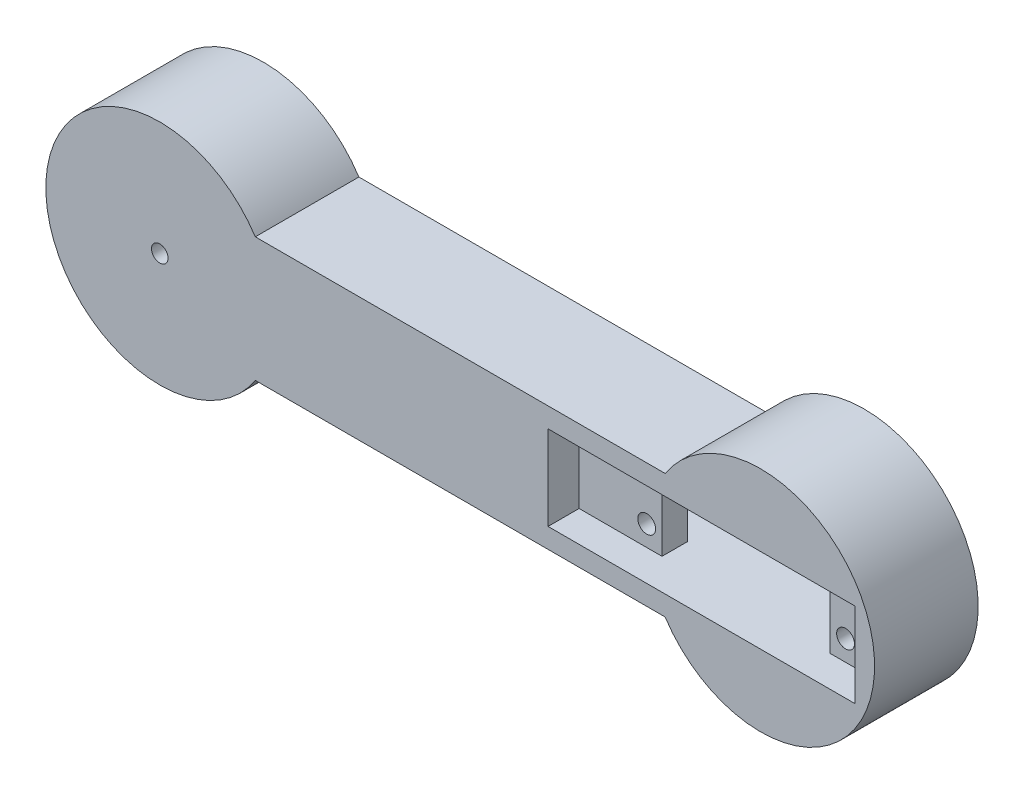
from build123d import *

# Parameters (mm, degrees)
BOSS_EXTRUDE1_DEPTH = 25
SKETCH19_R          = 20
CUT_EXTRUDE14_DEPTH = 5
SKETCH22_R          = 2
CUT_EXTRUDE17_DEPTH = 20
SKETCH23_W          = 54.5
SKETCH23_H          = 20.4
SKETCH23_W_2        = 40.6
CUT_EXTRUDE18_DEPTH = 11.3
CUT_EXTRUDE19_DEPTH = 13.7
SKETCH25_W          = 7.5
SKETCH25_H          = 20.4
CUT_EXTRUDE20_DEPTH = 13.5
CUT_EXTRUDE21_DEPTH = 20
SKETCH27_R          = 2.15
CUT_EXTRUDE22_DEPTH = 12


with BuildPart() as part:
    # Sketch1 → Boss-Extrude1 (new body)
    with BuildSketch(Plane.XY):
        with BuildLine():
            ThreePointArc((172.5, 0), (152.823244805, 26.363741023), (121.951138857, 15))
            Line((121.951138857, 15), (145, 15))
            Line((145, 15), (145, -15))
            Line((145, -15), (121.951138857, -15))
            ThreePointArc((121.951138857, -15), (152.823244805, -26.363741023), (172.5, 0))
        make_face()
        with BuildLine():
            Line((145, 15), (121.951138857, 15))
            ThreePointArc((121.951138857, 15), (117.5, 0), (121.951138857, -15))
            Line((121.951138857, -15), (145, -15))
            Line((145, -15), (145, 15))
        make_face()
        with BuildLine():
            Line((121.951138857, 15), (23.048861143, 15))
            ThreePointArc((23.048861143, 15), (26.363741023, 7.823244805), (27.5, 0))
            ThreePointArc((27.5, 0), (26.363741023, -7.823244805), (23.048861143, -15))
            Line((23.048861143, -15), (121.951138857, -15))
            ThreePointArc((121.951138857, -15), (117.5, 0), (121.951138857, 15))
        make_face()
        with BuildLine():
            ThreePointArc((13.228756555, -15), (-20, 0), (13.228756555, 15))
            Line((13.228756555, 15), (23.048861143, 15))
            ThreePointArc((23.048861143, 15), (-27.5, 0), (23.048861143, -15))
            Line((23.048861143, -15), (13.228756555, -15))
        make_face()
        with BuildLine():
            Line((23.048861143, 15), (13.228756555, 15))
            ThreePointArc((13.228756555, 15), (18.228756555, 8.228756555), (20, 0))
            ThreePointArc((20, 0), (18.228756555, -8.228756555), (13.228756555, -15))
            Line((13.228756555, -15), (23.048861143, -15))
            ThreePointArc((23.048861143, -15), (26.363741023, -7.823244805), (27.5, 0))
            ThreePointArc((27.5, 0), (26.363741023, 7.823244805), (23.048861143, 15))
        make_face()
        with BuildLine():
            Line((0, -15), (0, 15))
            Line((0, 15), (13.228756555, 15))
            ThreePointArc((13.228756555, 15), (-20, 0), (13.228756555, -15))
            Line((13.228756555, -15), (0, -15))
        make_face()
        with BuildLine():
            Line((13.228756555, 15), (0, 15))
            Line((0, 15), (0, -15))
            Line((0, -15), (13.228756555, -15))
            ThreePointArc((13.228756555, -15), (18.228756555, -8.228756555), (20, 0))
            ThreePointArc((20, 0), (18.228756555, 8.228756555), (13.228756555, 15))
        make_face()
    extrude(amount=BOSS_EXTRUDE1_DEPTH)

    # Sketch19 → Cut-Extrude14 (cut)
    with BuildSketch(Plane(origin=(0, 0, 0), x_dir=(-1, 0, 0), z_dir=(0, 0, -1))):
        Circle(SKETCH19_R)
    extrude(amount=-CUT_EXTRUDE14_DEPTH, mode=Mode.SUBTRACT)

    # Sketch22 → Cut-Extrude17 (cut)
    with BuildSketch(Plane.XY.offset(25)):
        Circle(SKETCH22_R)
    extrude(amount=-CUT_EXTRUDE17_DEPTH, mode=Mode.SUBTRACT)

    # Sketch23 → Cut-Extrude18 (cut)
    with BuildSketch(Plane(origin=(0, 0, 0), x_dir=(-1, 0, 0), z_dir=(0, 0, -1))):
        with Locations((-134, 0)):
            Rectangle(SKETCH23_W, SKETCH23_H)
        with Locations((-134, 0)):
            Rectangle(SKETCH23_W_2, SKETCH23_H)
    extrude(amount=-CUT_EXTRUDE18_DEPTH, mode=Mode.SUBTRACT)

    # Sketch24 → Cut-Extrude19 (cut)
    with BuildSketch(Plane(origin=(0, 0, 11.3), x_dir=(-1, 0, 0), z_dir=(0, 0, -1))):
        Polygon((-154.3, -0.627488927), (-154.3, -10.2), (-113.7, -10.2), (-113.7, 10.2), (-154.3, 10.2), align=None)
    extrude(amount=-CUT_EXTRUDE19_DEPTH, mode=Mode.SUBTRACT)

    # Sketch25 → Cut-Extrude20 (cut)
    with BuildSketch(Plane.ZY.offset(-154.3)):
        with Locations((21.25, 0)):
            Rectangle(SKETCH25_W, SKETCH25_H)
    extrude(amount=-CUT_EXTRUDE20_DEPTH, mode=Mode.SUBTRACT)

    # Sketch26 → Cut-Extrude21 (cut)
    with BuildSketch(Plane(origin=(113.7, 0, 0), x_dir=(0, 0, -1), z_dir=(1, 0, 0))):
        Polygon((-25, 10.2), (-25, -10.2), (-17.5, -10.2), (-17.5, 10.2), (-21.25, 10.2), align=None)
    extrude(amount=-CUT_EXTRUDE21_DEPTH, mode=Mode.SUBTRACT)

    # Sketch27 → Cut-Extrude22 (cut)
    with BuildSketch(Plane(origin=(0, 0, 11.3), x_dir=(-1, 0, 0), z_dir=(0, 0, -1))):
        with BuildLine():
            ThreePointArc((-107.85, 5.25), (-110, 7.4), (-112.15, 5.25))
            Line((-112.15, 5.25), (-110, 5.25))
            Line((-110, 5.25), (-110, 3.1))
            ThreePointArc((-110, 3.1), (-108.47972042, 3.72972042), (-107.85, 5.25))
        make_face()
        with BuildLine():
            Line((-110, 5.25), (-112.15, 5.25))
            ThreePointArc((-112.15, 5.25), (-111.52027958, 3.72972042), (-110, 3.1))
            Line((-110, 3.1), (-110, 5.25))
        make_face()
        with BuildLine():
            ThreePointArc((-110, -3.1), (-111.52027958, -3.72972042), (-112.15, -5.25))
            Line((-112.15, -5.25), (-110, -5.25))
            Line((-110, -5.25), (-110, -3.1))
        make_face()
        with BuildLine():
            Line((-110, -5.25), (-112.15, -5.25))
            ThreePointArc((-112.15, -5.25), (-110, -7.4), (-107.85, -5.25))
            ThreePointArc((-107.85, -5.25), (-108.47972042, -3.72972042), (-110, -3.1))
            Line((-110, -3.1), (-110, -5.25))
        make_face()
        with BuildLine():
            ThreePointArc((-155.85, 5.25), (-159.52027958, 6.77027958), (-158, 3.1))
            Line((-158, 3.1), (-158, 5.25))
            Line((-158, 5.25), (-155.85, 5.25))
        make_face()
        with BuildLine():
            Line((-158, 5.25), (-158, 3.1))
            ThreePointArc((-158, 3.1), (-156.47972042, 3.72972042), (-155.85, 5.25))
            Line((-155.85, 5.25), (-158, 5.25))
        make_face()
        with Locations((-158, -5.25)):
            Circle(SKETCH27_R)
    extrude(amount=-CUT_EXTRUDE22_DEPTH, mode=Mode.SUBTRACT)


solid = part.part
